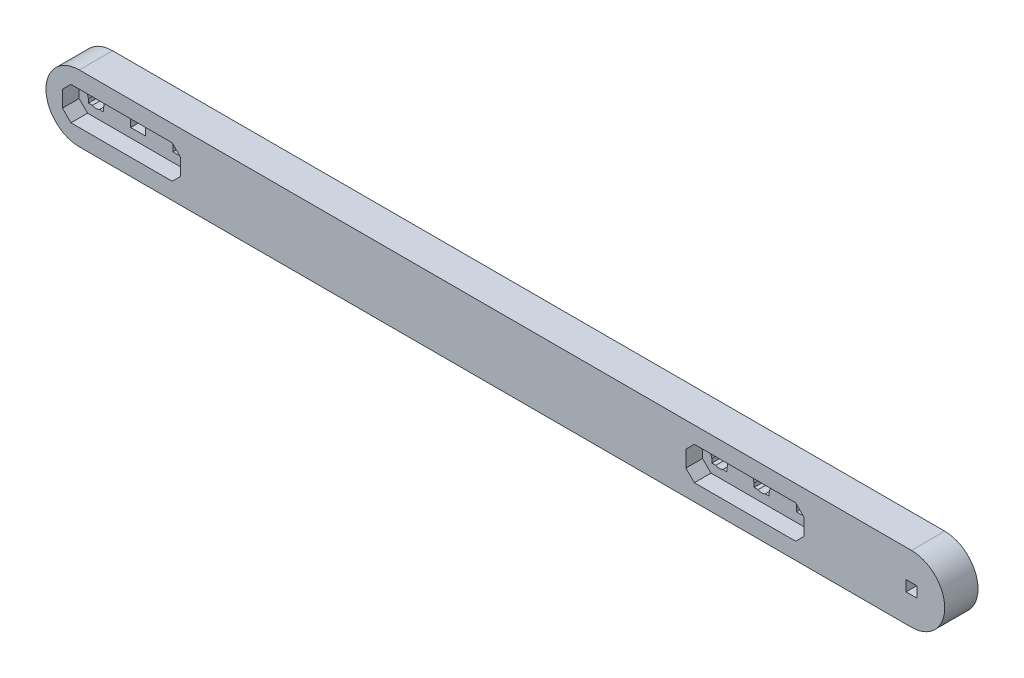
from build123d import *

# Parameters (mm, degrees)
SKETCH1_R           = 2.5
SKETCH1_W           = 3.2
SKETCH1_H           = 3.2
BOSS_EXTRUDE1_DEPTH = 10
SKETCH2_3_W         = 4.5
SKETCH2_3_H         = 4.5
CUT_EXTRUDE2_DEPTH  = 211.475651798
CUT_EXTRUDE1_START  = -5
SKETCH2_W           = 4.5
SKETCH2_H           = 4.5
CUT_EXTRUDE1_DEPTH  = 5


with BuildPart() as part:
    # Sketch1 → Boss-Extrude1 (new body)
    with BuildSketch(Plane.XY):
        with BuildLine():
            Line((50, 10), (-200, 10))
            ThreePointArc((-200, 10), (-210, 0), (-200, -10))
            Line((-200, -10), (50, -10))
            ThreePointArc((50, -10), (60, 0), (50, 10))
        make_face()
        Circle(SKETCH1_R, mode=Mode.SUBTRACT)
        with Locations((-200, 0)):
            Circle(SKETCH1_R, mode=Mode.SUBTRACT)
        with Locations((50, 0)):
            Rectangle(SKETCH1_W, SKETCH1_H, mode=Mode.SUBTRACT)
    extrude(amount=BOSS_EXTRUDE1_DEPTH)

    # Sketch2<3> → Cut-Extrude2 (cut, through all)
    with BuildSketch(Plane.XY.offset(10)):
        with Locations((12.7, 0)):
            Rectangle(SKETCH2_3_W, SKETCH2_3_H)
        Rectangle(SKETCH2_3_W, SKETCH2_3_H)
        with BuildLine():
            Line((-10.45, 1.089724736), (-10.45, 2.25))
            Line((-10.45, 2.25), (-11.610275264, 2.25))
            ThreePointArc((-11.610275264, 2.25), (-12.7, 2.5), (-13.789724736, 2.25))
            Line((-13.789724736, 2.25), (-14.95, 2.25))
            Line((-14.95, 2.25), (-14.95, 1.089724736))
            ThreePointArc((-14.95, 1.089724736), (-15.2, 0), (-14.95, -1.089724736))
            Line((-14.95, -1.089724736), (-14.95, -2.25))
            Line((-14.95, -2.25), (-13.789724736, -2.25))
            ThreePointArc((-13.789724736, -2.25), (-12.7, -2.5), (-11.610275264, -2.25))
            Line((-11.610275264, -2.25), (-10.45, -2.25))
            Line((-10.45, -2.25), (-10.45, -1.089724736))
            ThreePointArc((-10.45, -1.089724736), (-10.2, 0), (-10.45, 1.089724736))
        make_face()
        with Locations((-174.6, 0)):
            Rectangle(SKETCH2_3_W, SKETCH2_3_H)
        with Locations((-187.3, 0)):
            Rectangle(SKETCH2_3_W, SKETCH2_3_H)
        with BuildLine():
            Line((-197.75, 1.089724736), (-197.75, 2.25))
            Line((-197.75, 2.25), (-198.910275264, 2.25))
            ThreePointArc((-198.910275264, 2.25), (-200, 2.5), (-201.089724736, 2.25))
            Line((-201.089724736, 2.25), (-202.25, 2.25))
            Line((-202.25, 2.25), (-202.25, 1.089724736))
            ThreePointArc((-202.25, 1.089724736), (-202.5, 0), (-202.25, -1.089724736))
            Line((-202.25, -1.089724736), (-202.25, -2.25))
            Line((-202.25, -2.25), (-201.089724736, -2.25))
            ThreePointArc((-201.089724736, -2.25), (-200, -2.5), (-198.910275264, -2.25))
            Line((-198.910275264, -2.25), (-197.75, -2.25))
            Line((-197.75, -2.25), (-197.75, -1.089724736))
            ThreePointArc((-197.75, -1.089724736), (-197.5, 0), (-197.75, 1.089724736))
        make_face()
    extrude(amount=-CUT_EXTRUDE2_DEPTH, mode=Mode.SUBTRACT)

    # Sketch2 → Cut-Extrude1 (cut)
    # profile 1 of 2: a face of its own
    with BuildSketch(Plane.XY.offset(10).offset(CUT_EXTRUDE1_START)):
        Polygon((-15.21, -5), (15.21, -5), (17.75, -2.46), (17.75, 2.46), (15.21, 5), (-15.21, 5), (-17.75, 2.46), (-17.75, -2.46), align=None)
        with BuildLine():
            Line((-11.610275264, 2.25), (-10.45, 2.25))
            Line((-10.45, 2.25), (-10.45, 1.089724736))
            ThreePointArc((-10.45, 1.089724736), (-10.2, 0), (-10.45, -1.089724736))
            Line((-10.45, -1.089724736), (-10.45, -2.25))
            Line((-10.45, -2.25), (-11.610275264, -2.25))
            ThreePointArc((-11.610275264, -2.25), (-12.7, -2.5), (-13.789724736, -2.25))
            Line((-13.789724736, -2.25), (-14.95, -2.25))
            Line((-14.95, -2.25), (-14.95, -1.089724736))
            ThreePointArc((-14.95, -1.089724736), (-15.2, 0), (-14.95, 1.089724736))
            Line((-14.95, 1.089724736), (-14.95, 2.25))
            Line((-14.95, 2.25), (-13.789724736, 2.25))
            ThreePointArc((-13.789724736, 2.25), (-12.7, 2.5), (-11.610275264, 2.25))
        make_face(mode=Mode.SUBTRACT)
        with BuildLine():
            Line((1.089724736, 2.25), (2.25, 2.25))
            Line((2.25, 2.25), (2.25, 1.089724736))
            ThreePointArc((2.25, 1.089724736), (2.5, 0), (2.25, -1.089724736))
            Line((2.25, -1.089724736), (2.25, -2.25))
            Line((2.25, -2.25), (1.089724736, -2.25))
            ThreePointArc((1.089724736, -2.25), (0, -2.5), (-1.089724736, -2.25))
            Line((-1.089724736, -2.25), (-2.25, -2.25))
            Line((-2.25, -2.25), (-2.25, -1.089724736))
            ThreePointArc((-2.25, -1.089724736), (-2.5, 0), (-2.25, 1.089724736))
            Line((-2.25, 1.089724736), (-2.25, 2.25))
            Line((-2.25, 2.25), (-1.089724736, 2.25))
            ThreePointArc((-1.089724736, 2.25), (0, 2.5), (1.089724736, 2.25))
        make_face(mode=Mode.SUBTRACT)
        with Locations((12.7, 0)):
            Rectangle(SKETCH2_W, SKETCH2_H, mode=Mode.SUBTRACT)
    # profile 2 of 2: a face of its own
    with BuildSketch(Plane.XY.offset(10).offset(CUT_EXTRUDE1_START)):
        Polygon((-202.51, -5), (-172.09, -5), (-169.55, -2.46), (-169.55, 2.46), (-172.09, 5), (-202.51, 5), (-205.05, 2.46), (-205.05, -2.46), align=None)
        with BuildLine():
            Line((-198.910275264, 2.25), (-197.75, 2.25))
            Line((-197.75, 2.25), (-197.75, 1.089724736))
            ThreePointArc((-197.75, 1.089724736), (-197.5, 0), (-197.75, -1.089724736))
            Line((-197.75, -1.089724736), (-197.75, -2.25))
            Line((-197.75, -2.25), (-198.910275264, -2.25))
            ThreePointArc((-198.910275264, -2.25), (-200, -2.5), (-201.089724736, -2.25))
            Line((-201.089724736, -2.25), (-202.25, -2.25))
            Line((-202.25, -2.25), (-202.25, -1.089724736))
            ThreePointArc((-202.25, -1.089724736), (-202.5, 0), (-202.25, 1.089724736))
            Line((-202.25, 1.089724736), (-202.25, 2.25))
            Line((-202.25, 2.25), (-201.089724736, 2.25))
            ThreePointArc((-201.089724736, 2.25), (-200, 2.5), (-198.910275264, 2.25))
        make_face(mode=Mode.SUBTRACT)
        with Locations((-187.3, 0)):
            Rectangle(SKETCH2_W, SKETCH2_H, mode=Mode.SUBTRACT)
        with Locations((-174.6, 0)):
            Rectangle(SKETCH2_W, SKETCH2_H, mode=Mode.SUBTRACT)
    extrude(amount=CUT_EXTRUDE1_DEPTH, mode=Mode.SUBTRACT)


solid = part.part
